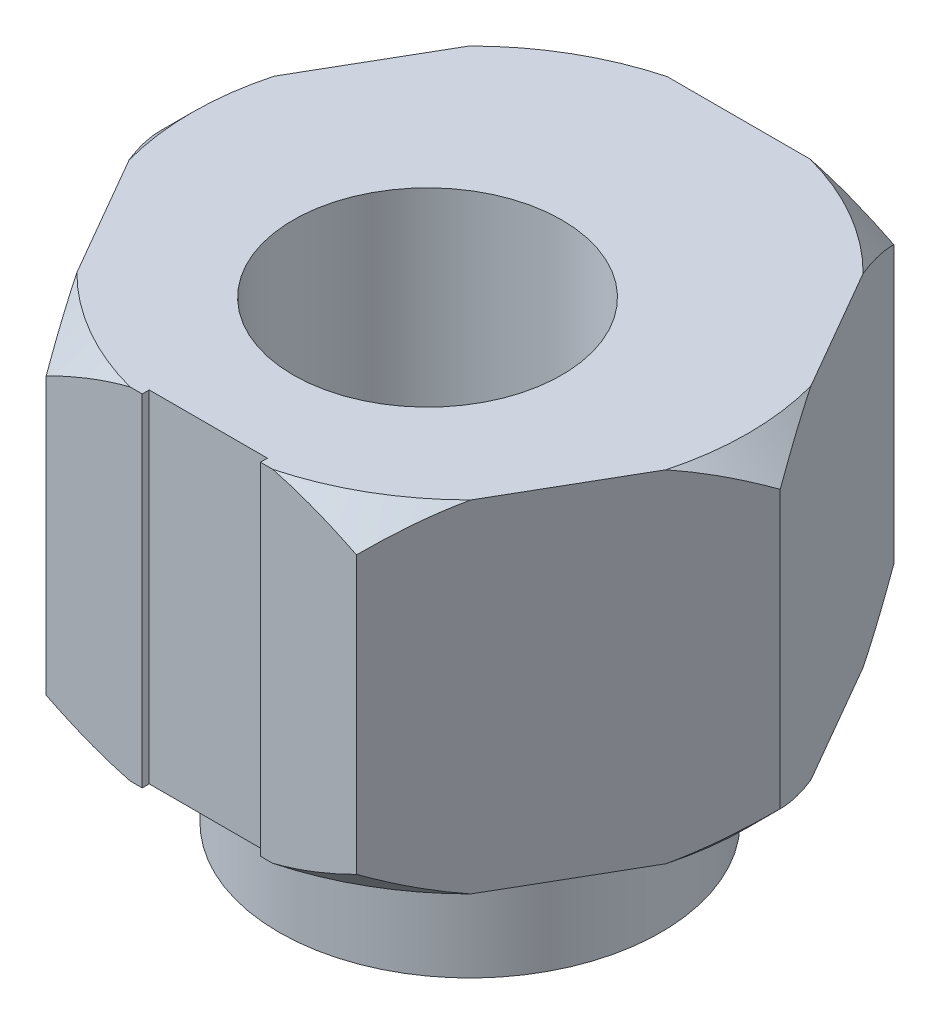
from build123d import *

# Parameters (mm, degrees)
BOSS_EXTRUDE1_DEPTH = 6.35
SKETCH3_R           = 3.555
BOSS_EXTRUDE3_DEPTH = 2.5
SKETCH4_R           = 2.5
CUT_EXTRUDE1_DEPTH  = 12.689988594
SKETCH5_W           = 2.2
SKETCH5_H           = 0.13
CUT_EXTRUDE2_DEPTH  = 10.932564288


with BuildPart() as part:
    # Sketch1 → Boss-Extrude1 (new body)
    with BuildSketch(Plane(origin=(0, 0, 0), x_dir=(1, 0, 0), z_dir=(0, 1, 0))):
        Polygon((5.773502692, 0), (2.886751346, 5), (-2.886751346, 5), (-5.773502692, 0), (-2.886751346, -5), (2.886751346, -5), align=None)
    extrude(amount=BOSS_EXTRUDE1_DEPTH)

    # Sketch3 → Boss-Extrude3 (add)
    with BuildSketch(Plane.XZ):
        with Locations(Location((0, 0, 0), (0, 0, 90))):
            Circle(SKETCH3_R)
    extrude(amount=BOSS_EXTRUDE3_DEPTH)

    # Sketch4 → Cut-Extrude1 (cut, through all)
    with BuildSketch(Plane(origin=(0, 6.35, 0), x_dir=(1, 0, 0), z_dir=(0, 1, 0))):
        with Locations(Location((0, -0.79, 0), (0, 0, 270))):
            Circle(SKETCH4_R)
    extrude(amount=-CUT_EXTRUDE1_DEPTH, mode=Mode.SUBTRACT)

    # Sketch5 → Cut-Extrude2 (cut, through all)
    with BuildSketch(Plane(origin=(0, 0, 0), x_dir=(-1, 0, 0), z_dir=(0, -1, 0))):
        with Locations((0, -4.935)):
            Rectangle(SKETCH5_W, SKETCH5_H)
    extrude(amount=-CUT_EXTRUDE2_DEPTH, mode=Mode.SUBTRACT)

    # Sketch6 → Cut-Revolve1 (revolve, cut)
    with BuildSketch(Plane.XY):
        Polygon((5.173502692, 6.35), (5.773502692, 6.35), (5.773502692, 5.75), align=None)
        Polygon((5.773502692, 0.6), (5.173502692, 0), (5.773502692, 0), align=None)
    revolve(axis=Axis((0, 0, 0), (0, 1, 0)), mode=Mode.SUBTRACT)


solid = part.part
